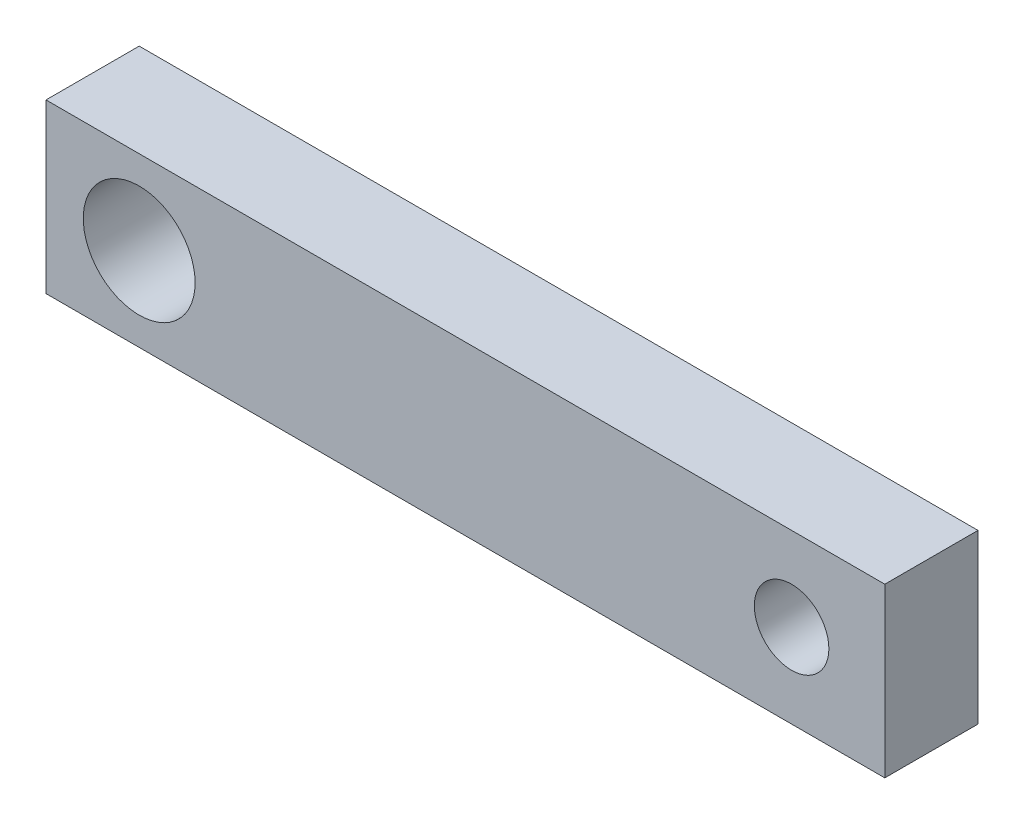
from build123d import *

# Parameters (mm, degrees)
SKETCH1_W           = 180
SKETCH1_H           = 36
SKETCH1_R           = 12
SKETCH1_R_2         = 8
BOSS_EXTRUDE1_DEPTH = 20


with BuildPart() as part:
    # Sketch1 → Boss-Extrude1 (new body)
    with BuildSketch(Plane.XY):
        with Locations((70, 0)):
            Rectangle(SKETCH1_W, SKETCH1_H)
        Circle(SKETCH1_R, mode=Mode.SUBTRACT)
        with Locations((140, 0)):
            Circle(SKETCH1_R_2, mode=Mode.SUBTRACT)
    extrude(amount=BOSS_EXTRUDE1_DEPTH)


solid = part.part
